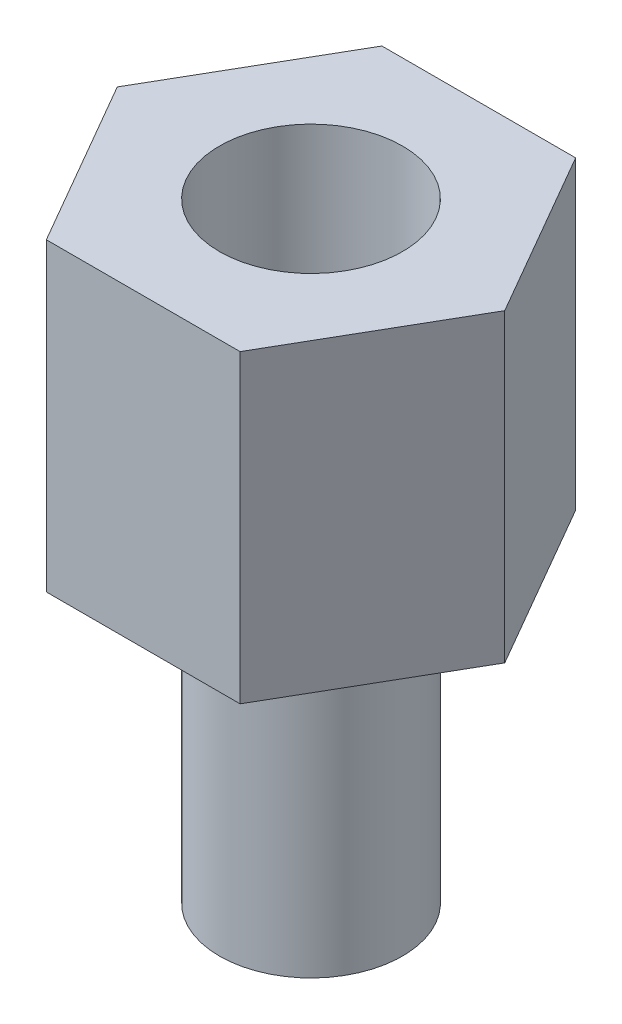
from build123d import *

# Parameters (mm, degrees)
IZIM1_R                     = 1.5
Y_KSEKLIK_EKSTR_ZYON1_DEPTH = 5
Y_KSEKLIK_EKSTR_ZYON2_START = -5
IZIM1_2_R                   = 1.5
Y_KSEKLIK_EKSTR_ZYON2_DEPTH = 7


with BuildPart() as part:
    # Çizim1 → Yükseklik-Ekstrüzyon1 (new body)
    with BuildSketch(Plane(origin=(0, 0, 0), x_dir=(1, 0, 0), z_dir=(0, 1, 0))):
        Polygon((1.58771324, -2.75), (3.175426481, 0), (1.58771324, 2.75), (-1.58771324, 2.75), (-3.175426481, 0), (-1.58771324, -2.75), align=None)
        Circle(IZIM1_R, mode=Mode.SUBTRACT)
    extrude(amount=Y_KSEKLIK_EKSTR_ZYON1_DEPTH)

    # Çizim1<2> → Yükseklik-Ekstrüzyon2 (add)
    with BuildSketch(Plane(origin=(0, 0, 0), x_dir=(1, 0, 0), z_dir=(0, 1, 0)).offset(Y_KSEKLIK_EKSTR_ZYON2_START)):
        Circle(IZIM1_2_R)
    extrude(amount=Y_KSEKLIK_EKSTR_ZYON2_DEPTH)


solid = part.part
